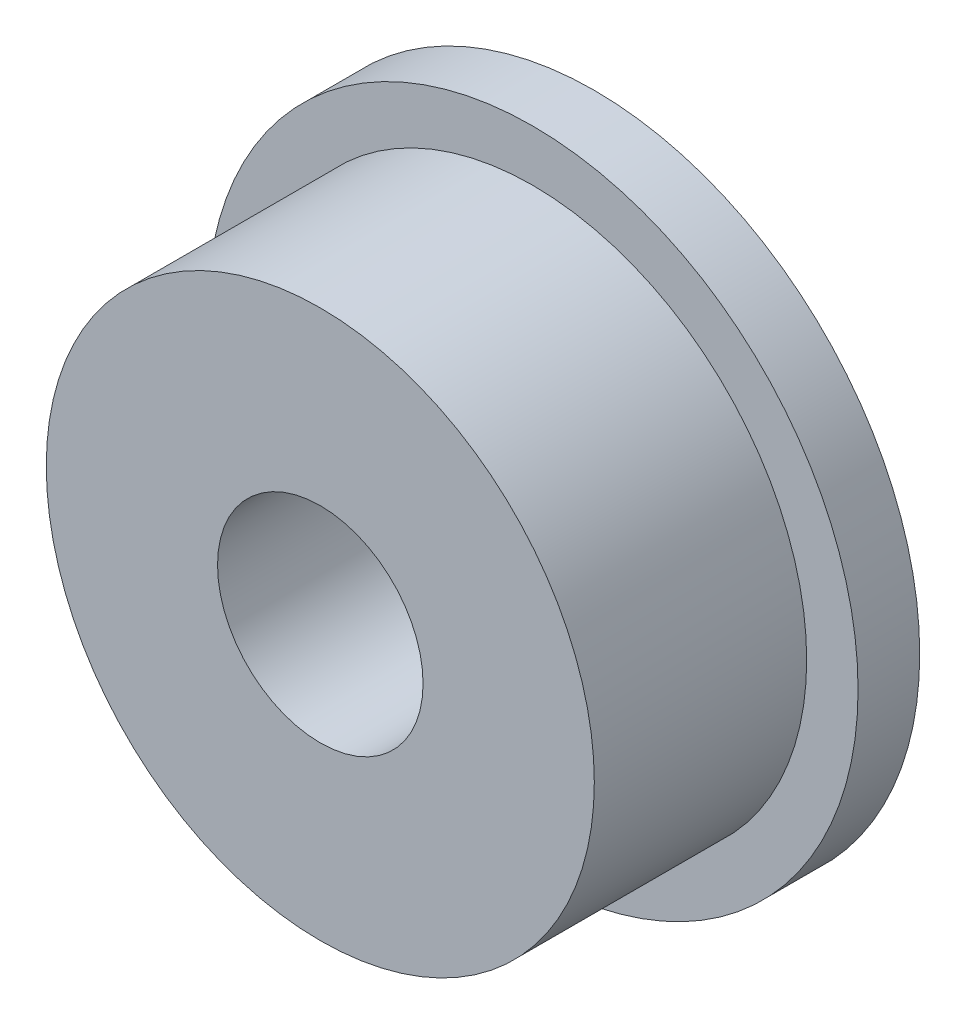
from build123d import *

# Parameters (mm, degrees)
F693ZZ_EXTERNAL_ENVELOPE_3X8X4_START = -2.5
SKETCH1_R                            = 4
SKETCH1_R_2                          = 1.5
F693ZZ_EXTERNAL_ENVELOPE_3X8X4_DEPTH = 4
FLANGE_9P5X0P9_START                 = -2.5
SKETCH2_R                            = 4.75
SKETCH2_R_2                          = 1.5
FLANGE_9P5X0P9_DEPTH                 = 0.9


with BuildPart() as part:
    # Sketch1 → F693ZZ_External_Envelope_3x8x4 (new body)
    with BuildSketch(Plane.XY.offset(F693ZZ_EXTERNAL_ENVELOPE_3X8X4_START)):
        Circle(SKETCH1_R)
        Circle(SKETCH1_R_2, mode=Mode.SUBTRACT)
    extrude(amount=F693ZZ_EXTERNAL_ENVELOPE_3X8X4_DEPTH)

    # Sketch2 → Flange_9p5x0p9 (add)
    with BuildSketch(Plane.XY.offset(FLANGE_9P5X0P9_START)):
        Circle(SKETCH2_R)
        Circle(SKETCH2_R_2, mode=Mode.SUBTRACT)
    extrude(amount=FLANGE_9P5X0P9_DEPTH)


solid = part.part
